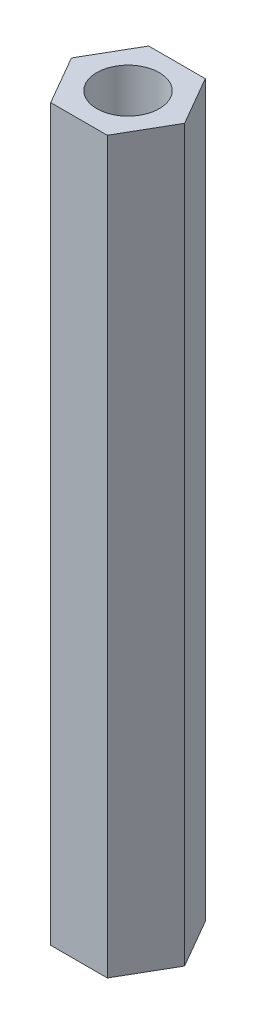
from build123d import *

# Parameters (mm, degrees)
SKETCH1_R           = 1.5
BOSS_EXTRUDE1_DEPTH = 35


with BuildPart() as part:
    # Sketch1 → Boss-Extrude1 (new body)
    with BuildSketch(Plane(origin=(0, 0, 0), x_dir=(1, 0, 0), z_dir=(0, 1, 0))):
        Polygon((2.713546265, 0), (1.356773133, 2.35), (-1.356773133, 2.35), (-2.713546265, 0), (-1.356773133, -2.35), (1.356773133, -2.35), align=None)
        with Locations(Location((0, 0, 0), (0, 0, 270))):
            Circle(SKETCH1_R, mode=Mode.SUBTRACT)
    extrude(amount=BOSS_EXTRUDE1_DEPTH)


solid = part.part
